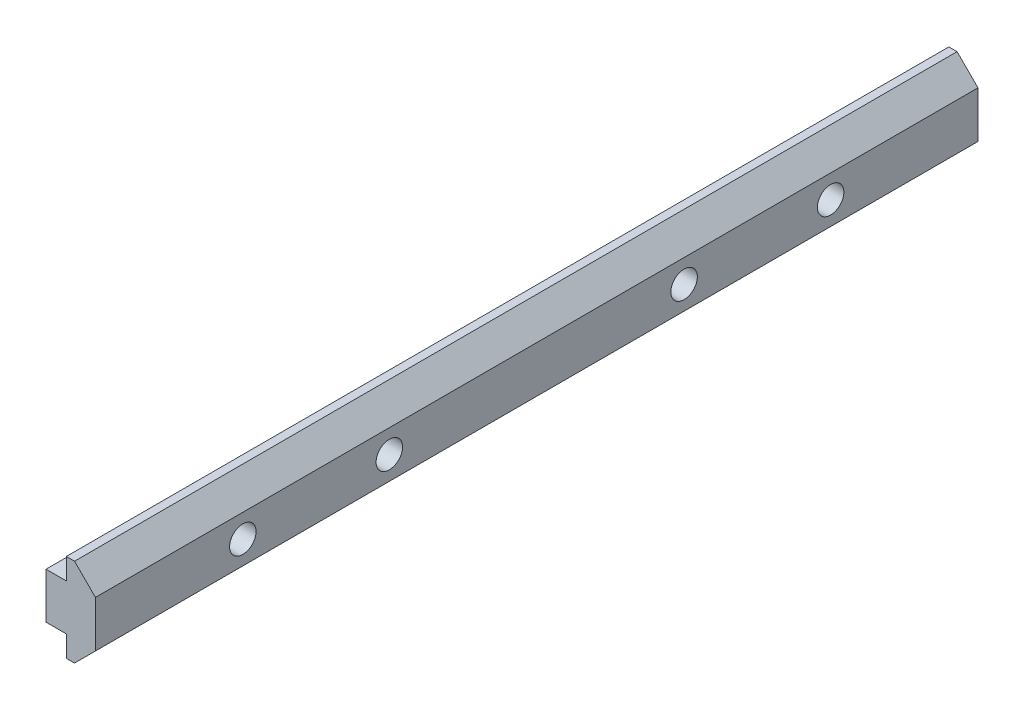
from build123d import *

# Parameters (mm, degrees)
BOSS_EXTRUDE1_DEPTH = 100
SKETCH2_R           = 1.5
CUT_EXTRUDE1_DEPTH  = 20


with BuildPart() as part:
    # Sketch1 → Boss-Extrude1 (new body)
    with BuildSketch(Plane.XY):
        Polygon((-10, 2.6), (-7.7, 2.6), (-7.7, 5), (-6.767766953, 5), (-4.4, 2.632233047), (-4.4, -2.632233047), (-6.767766953, -5), (-7.7, -5), (-7.7, -2.6), (-10, -2.6), align=None)
    extrude(amount=BOSS_EXTRUDE1_DEPTH)

    # Sketch2 → Cut-Extrude1 (cut)
    with BuildSketch(Plane.ZY.offset(10)):
        with Locations((83.3, 0)):
            Circle(SKETCH2_R)
        with Locations((66.7, 0)):
            Circle(SKETCH2_R)
        with Locations(Location((16.7, 0, 0), (0, 0, 270))):
            Circle(SKETCH2_R)
        with Locations(Location((33.3, 0, 0), (0, 0, 270))):
            Circle(SKETCH2_R)
    extrude(amount=-CUT_EXTRUDE1_DEPTH, mode=Mode.SUBTRACT)


solid = part.part
